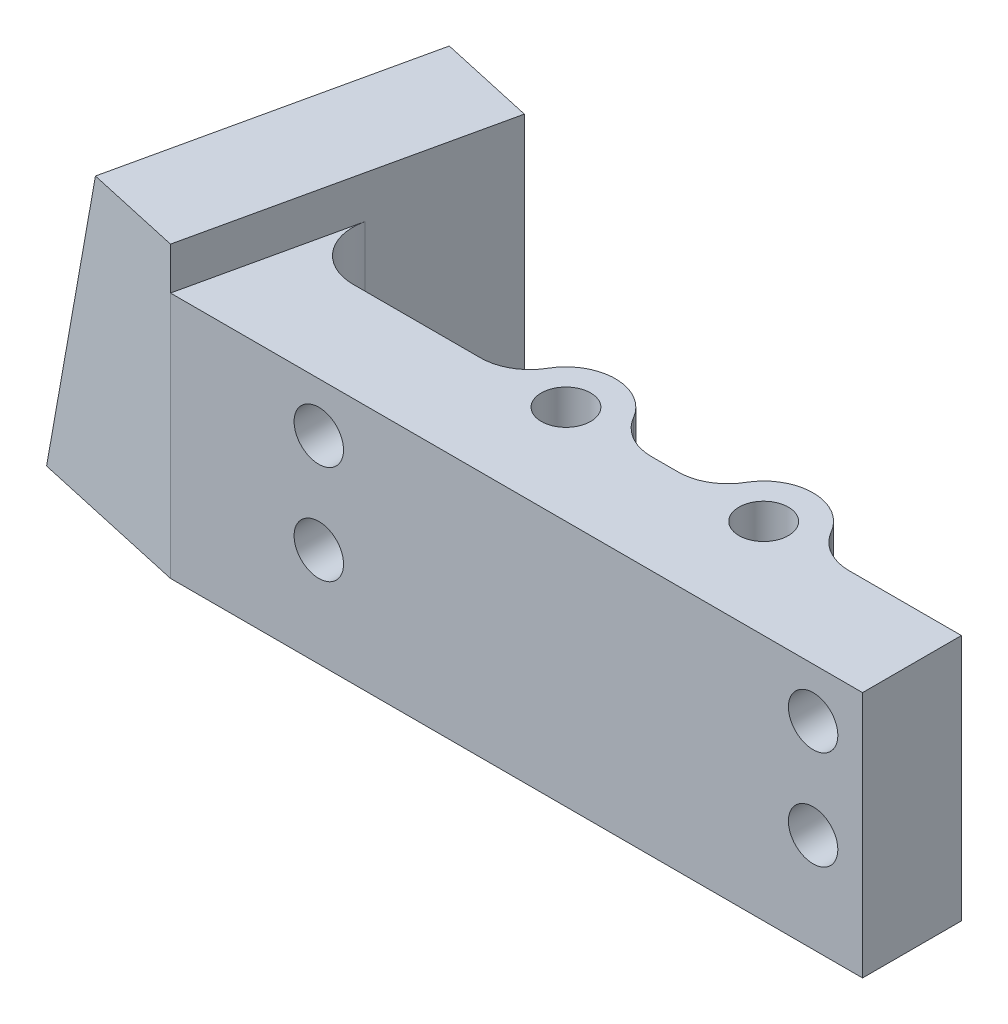
from build123d import *

# Parameters (mm, degrees)
BOSS_EXTRUDE1_DEPTH             = 37.19322
BOSS_EXTRUDE2_DEPTH             = 31.75
DRAFT1_ANGLE                    = 12.53
F_1_4_0_25_DIAMETER_HOLE2_D     = 6.35
CUT_EXTRUDE2_DEPTH              = 25.4
F_1_4_0_25_DIAMETER_HOLE3_D     = 6.35
F_1_4_0_25_DIAMETER_HOLE3_DEPTH = 31.75
F_1_4_0_25_DIAMETER_HOLE3_TIP   = 1.907732465
F_1_4_20_TAPPED_HOLE1_D         = 5.1054
F_1_4_20_TAPPED_HOLE1_DEPTH     = 12.7
F_1_4_20_TAPPED_HOLE1_TIP       = 1.533816902


with BuildPart() as part:
    # Sketch1 → Boss-Extrude1 (new body)
    with BuildSketch(Plane(origin=(0, 0, 0), x_dir=(1, 0, 0), z_dir=(0, 1, 0))):
        Polygon((-48.582525221, 30.31081915), (-36.184949557, 27.555802336), (-44.45, -9.636924657), (-56.847575664, -6.881907843), align=None)
    extrude(amount=BOSS_EXTRUDE1_DEPTH)

    # Sketch8 → Boss-Extrude2 (add)
    with BuildSketch(Plane(origin=(0, 0, 0), x_dir=(1, 0, 0), z_dir=(0, 1, 0))):
        Polygon((-36.184949557, 27.555802336), (44.45, 3.063075343), (44.45, -9.636924657), (-44.45, -9.636924657), align=None)
    extrude(amount=BOSS_EXTRUDE2_DEPTH)

    # Draft1
    draft1_faces = [part.faces().sort_by_distance(p)[0] for p in [
        (-52.715050443, 18.59661, -11.714455654),
    ]]
    draft(draft1_faces, Plane.ZX.offset(37.19322), DRAFT1_ANGLE)

    # 1/4 (0.25) Diameter Hole2 (through all)
    with Locations(Plane(origin=(0, 31.75, 0), x_dir=(1, 0, 0), z_dir=(0, 1, 0))):
        with Locations((-6.35, 3.063075343), (19.05, 3.063075343)):
            Hole(F_1_4_0_25_DIAMETER_HOLE2_D / 2)

    # Sketch13 → Cut-Extrude2 (cut)
    with BuildSketch(Plane(origin=(0, 31.75, 0), x_dir=(1, 0, 0), z_dir=(0, 1, 0))):
        with BuildLine():
            Line((-36.184949557, 27.555802336), (-39.910553687, 10.79058375))
            ThreePointArc((-39.910553687, 10.79058375), (-38.665031363, 5.439706394), (-33.711765855, 3.063075343))
            Line((-33.711765855, 3.063075343), (-17.348522628, 3.063075343))
            ThreePointArc((-17.348522628, 3.063075343), (-14.173522628, 3.913814029), (-11.849261314, 6.238075343))
            ThreePointArc((-11.849261314, 6.238075343), (-6.35, 9.413075343), (-0.850738686, 6.238075343))
            ThreePointArc((-0.850738686, 6.238075343), (1.473522628, 3.913814029), (4.648522628, 3.063075343))
            Line((4.648522628, 3.063075343), (8.051477372, 3.063075343))
            ThreePointArc((8.051477372, 3.063075343), (11.226477372, 3.913814029), (13.550738686, 6.238075343))
            ThreePointArc((13.550738686, 6.238075343), (19.05, 9.413075343), (24.549261314, 6.238075343))
            ThreePointArc((24.549261314, 6.238075343), (26.873522628, 3.913814029), (30.048522628, 3.063075343))
            Line((30.048522628, 3.063075343), (44.45, 3.063075343))
            Line((44.45, 3.063075343), (-36.184949557, 27.555802336))
        make_face()
    extrude(amount=-CUT_EXTRUDE2_DEPTH, mode=Mode.SUBTRACT)

    # 1/4 (0.25) Diameter Hole3
    with Locations(Plane.XY.offset(9.636924657)):
        with Locations((38.1, 25.4), (38.1, 12.7), (-25.4, 25.4), (-25.4, 12.7)):
            Hole(F_1_4_0_25_DIAMETER_HOLE3_D / 2, depth=F_1_4_0_25_DIAMETER_HOLE3_DEPTH)
            with Locations((0, 0, -(F_1_4_0_25_DIAMETER_HOLE3_DEPTH + F_1_4_0_25_DIAMETER_HOLE3_TIP / 2))):  # 118° drill point
                Cone(0, F_1_4_0_25_DIAMETER_HOLE3_D / 2, F_1_4_0_25_DIAMETER_HOLE3_TIP, mode=Mode.SUBTRACT)

    # 1/4-20 Tapped Hole1
    with Locations(Plane(origin=(-57.923217538, 13.187114971, -12.87182612), x_dir=(-0.20648022911920935, 0.04700841279958709, 0.977320891063392), z_dir=(-0.9529367695675907, 0.2169507716396215, -0.21176372657057574))):
        with Locations((13.563707416, 17.609083513), (12.340640779, -7.762134727), (-8.941294908, 12.336703083), (-9.552900666, -0.349243556)):
            Hole(F_1_4_20_TAPPED_HOLE1_D / 2, depth=F_1_4_20_TAPPED_HOLE1_DEPTH)
            with Locations((0, 0, -(F_1_4_20_TAPPED_HOLE1_DEPTH + F_1_4_20_TAPPED_HOLE1_TIP / 2))):  # 118° drill point
                Cone(0, F_1_4_20_TAPPED_HOLE1_D / 2, F_1_4_20_TAPPED_HOLE1_TIP, mode=Mode.SUBTRACT)


solid = part.part
